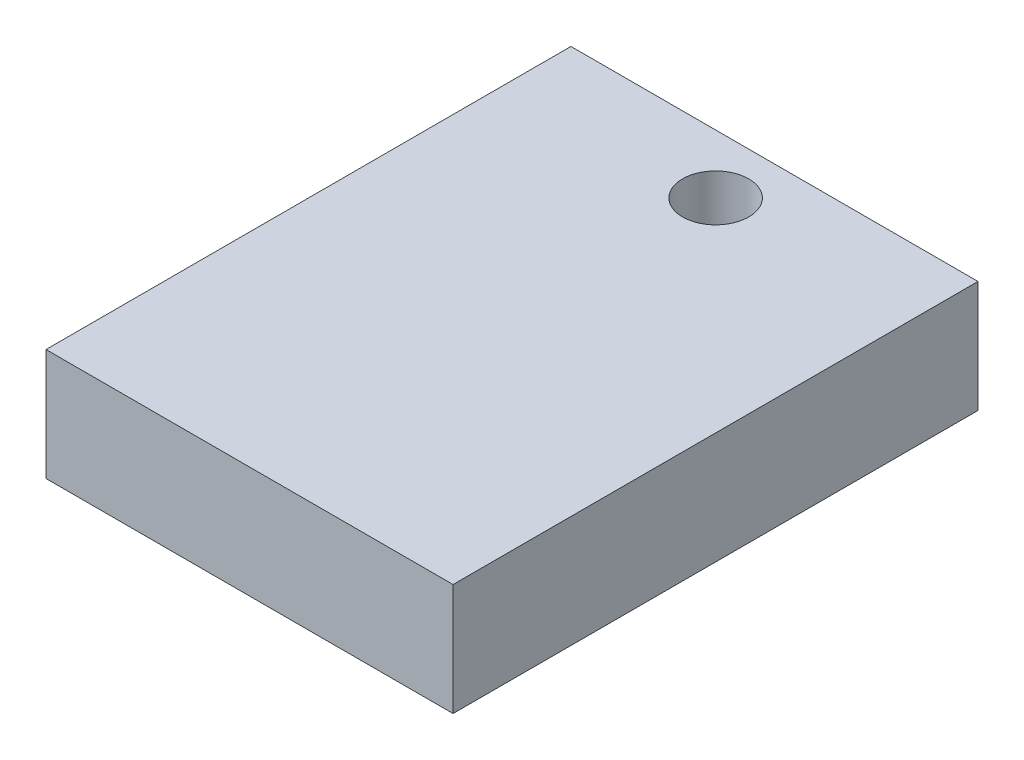
from build123d import *

# Parameters (mm, degrees)
SKETCH1_W           = 43.942
SKETCH1_H           = 56.6674
SKETCH1_R           = 3.57
BOSS_EXTRUDE1_DEPTH = 12.065


with BuildPart() as part:
    # Sketch1 → Boss-Extrude1 (new body)
    with BuildSketch(Plane(origin=(0, 0, 0), x_dir=(1, 0, 0), z_dir=(0, 1, 0))):
        with Locations((21.971, -28.3337)):
            Rectangle(SKETCH1_W, SKETCH1_H)
        with Locations(Location((21.971, -6.35, 0), (0, 0, 90))):
            Circle(SKETCH1_R, mode=Mode.SUBTRACT)
    extrude(amount=BOSS_EXTRUDE1_DEPTH)


solid = part.part
